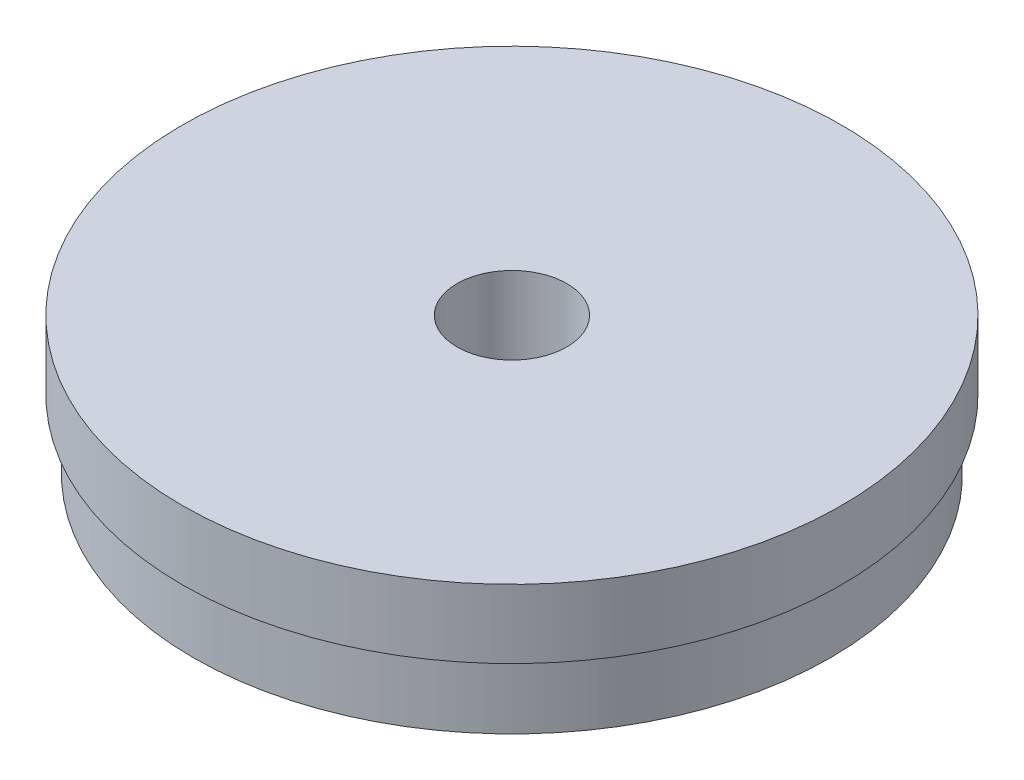
from build123d import *

# Parameters (mm, degrees)
SKETCH2_R          = 20
CUT_EXTRUDE1_DEPTH = 177.91806013


with BuildPart() as part:
    # Sketch1 → Revolve1 (revolve)
    with BuildSketch(Plane.XY, mode=Mode.PRIVATE) as revolve1_sk:
        Polygon((0, 48.053571429), (120, 48.053571429), (120, 23.053571429), (116, 23.053571429), (116, -1.946428571), (0, -1.946428571), align=None)
    revolve(revolve1_sk.sketch.rotate(Axis((0, 53.160714286, 0), (0, -1, 0)), 90), axis=Axis((0, 53.160714286, 0), (0, -1, 0)))

    # Sketch2 → Cut-Extrude1 (cut, through all)
    with BuildSketch(Plane(origin=(0, 48.053571429, 0), x_dir=(1, 0, 0), z_dir=(0, 1, 0))):
        with Locations(Location((0, 0, 0), (0, 0, 270))):
            Circle(SKETCH2_R)
    extrude(amount=-CUT_EXTRUDE1_DEPTH, mode=Mode.SUBTRACT)


solid = part.part
